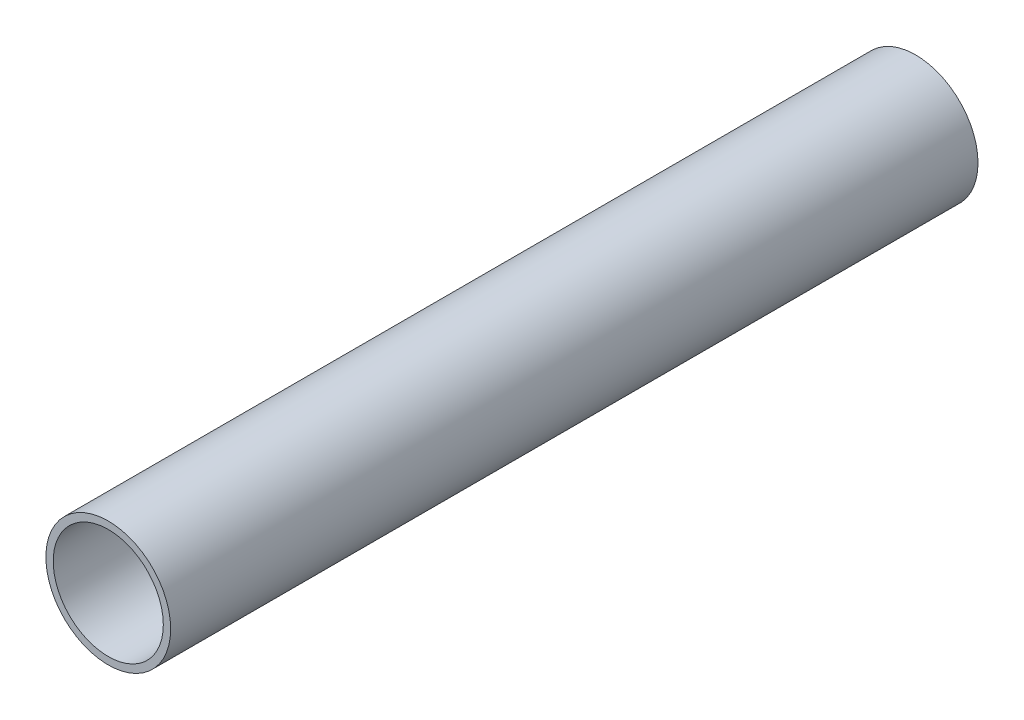
from build123d import *

# Parameters (mm, degrees)
SKETCH1_R           = 17
SKETCH1_R_2         = 15
BOSS_EXTRUDE1_DEPTH = 110


with BuildPart() as part:
    # Sketch1 → Boss-Extrude1 (new, symmetric)
    with BuildSketch(Plane.XY):
        Circle(SKETCH1_R)
        Circle(SKETCH1_R_2, mode=Mode.SUBTRACT)
    extrude(amount=BOSS_EXTRUDE1_DEPTH, both=True)


solid = part.part
